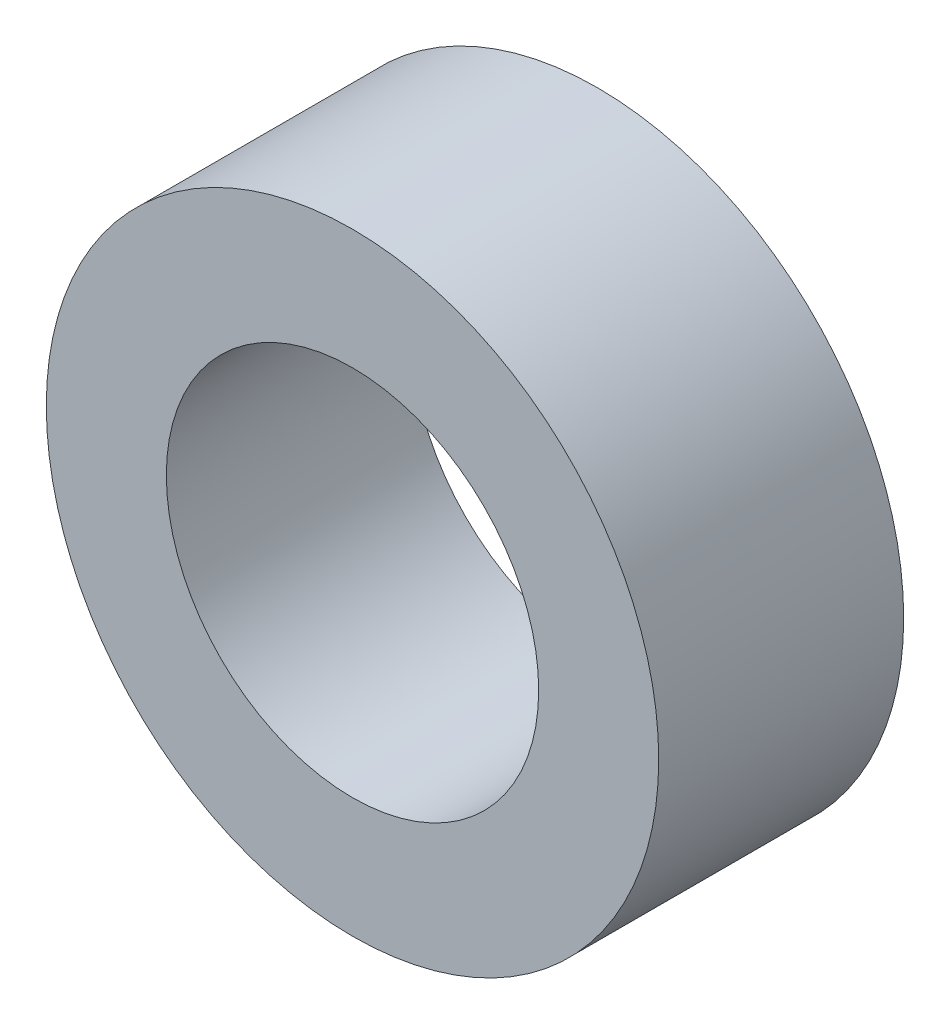
from build123d import *

# Parameters (mm, degrees)
BOSS_EXTRUDE1_DEPTH      = 152.4
BOSS_EXTRUDE1_DEPTH_BACK = 152.4
SKETCH3_R                = 7.9375
SKETCH3_R_2              = 4.826
SKETCH4_R                = 7.9375
CUT_EXTRUDE1_DEPTH       = 298.45


with BuildPart() as part:
    # Sketch3 → Boss-Extrude1 (new, two sides: drawn at the far end of the back side and taken through both)
    with BuildSketch(Plane.XY.offset(-BOSS_EXTRUDE1_DEPTH_BACK)):
        Circle(SKETCH3_R)
        Circle(SKETCH3_R_2, mode=Mode.SUBTRACT)
    extrude(amount=BOSS_EXTRUDE1_DEPTH + BOSS_EXTRUDE1_DEPTH_BACK)

    # Sketch4 → Cut-Extrude1 (cut)
    with BuildSketch(Plane.XY.offset(152.4)):
        Circle(SKETCH4_R)
    extrude(amount=-CUT_EXTRUDE1_DEPTH, mode=Mode.SUBTRACT)


solid = part.part
